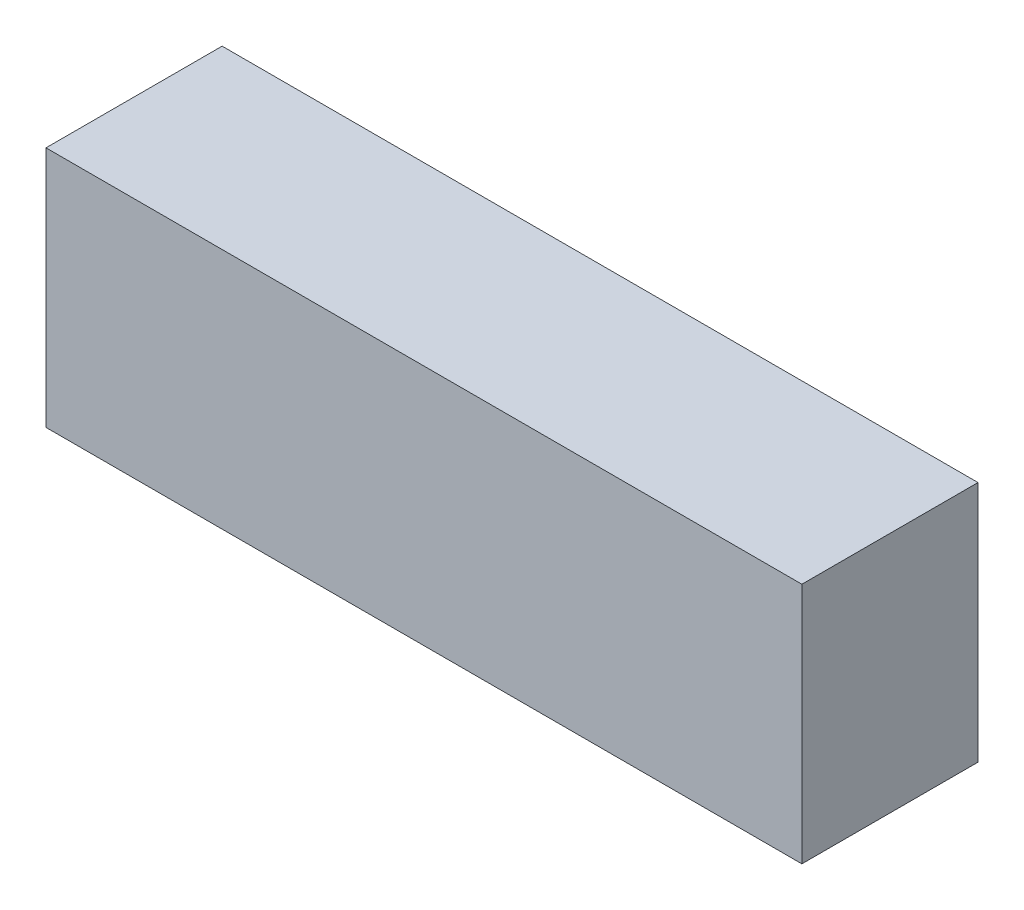
from build123d import *

# Parameters (mm, degrees)
SKETCH1_W           = 103
SKETCH1_H           = 33
BOSS_EXTRUDE1_DEPTH = 24


with BuildPart() as part:
    # Sketch1 → Boss-Extrude1 (new body)
    with BuildSketch(Plane.XY):
        with Locations((-11.121012329, 37.037027001)):
            Rectangle(SKETCH1_W, SKETCH1_H)
    extrude(amount=BOSS_EXTRUDE1_DEPTH)


solid = part.part
